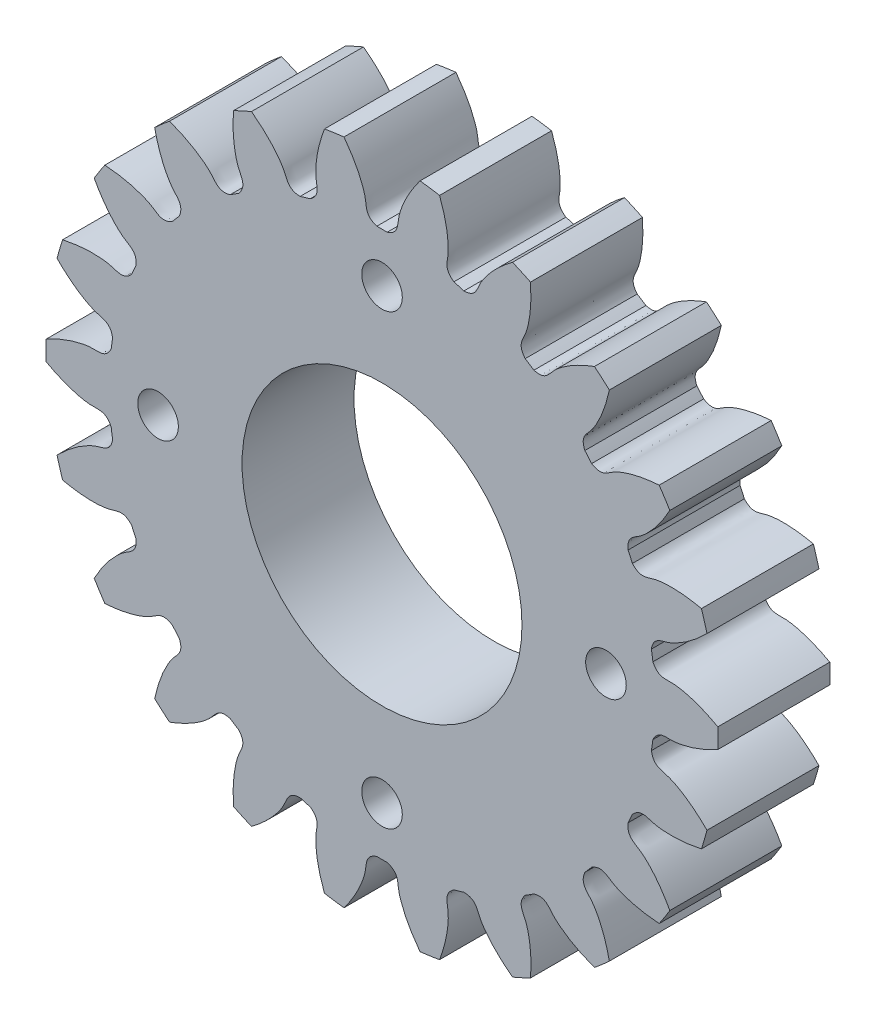
from build123d import *

# Parameters (mm, degrees)
SKETCH_1_R               = 24
EXTRUDE_1_DEPTH          = 8
CUT_EXTRUDE_1_DEPTH      = 35.871191548
PATTERN_CIRCULAR_1_COUNT = 22
SKETCH_4_R               = 1.45
CUT_EXTRUDE_2_DEPTH      = 35.765198942
SKETCH_5_R               = 10
CUT_EXTRUDE_3_DEPTH      = 35.765198942


with BuildPart() as part:
    # 草图1 → 凸台-拉伸1 (new body)
    with BuildSketch(Plane.XY):
        Circle(SKETCH_1_R)
    extrude(amount=EXTRUDE_1_DEPTH)

    # 草图2 → 切除-拉伸1 (cut, through all)
    with BuildSketch(Plane.XY):
        with BuildLine():
            ThreePointArc((0.371330863, 19.496464125), (0, 19.5), (-0.371330863, 19.496464125))
            add(Edge.make_bspline(
                [(-0.371330863, 19.496464125), (-1.176317412, 19.752372857), (-1.096694528, 20.303549391), (-1.199168094, 20.843140781), (-1.211922359, 20.903837805), (-1.227753794, 20.972324425), (-1.246967442, 21.048500862), (-1.269879867, 21.132255307), (-1.296799885, 21.223467323), (-1.328034341, 21.322006878), (-1.363885982, 21.427734756), (-1.40465378, 21.54050256), (-1.45063252, 21.660152836), (-1.502112606, 21.786519179), (-1.559379803, 21.919426344), (-1.622715011, 22.058690369), (-1.692394023, 22.204118701), (-1.768687299, 22.355510324), (-1.851859737, 22.512655901), (-1.94217045, 22.675337914), (-2.039872542, 22.843330816), (-2.145212897, 23.016401181), (-2.258431958, 23.19430787), (-2.379763526, 23.376802189), (-2.509434547, 23.563628066), (-2.647664919, 23.754522223), (-2.794667288, 23.949214355), (-2.950646862, 24.147427323), (-3.115801217, 24.348877336), (-3.29032012, 24.553274152), (-3.474385347, 24.760321276), (-3.668170511, 24.969716162), (-3.871840895, 25.181150429), (-4.085553283, 25.394310066), (-4.309455811, 25.608875654), (-4.543687807, 25.824522587), (-4.788379645, 26.040921297), (-5.043652617, 26.257737482), (-5.309618726, 26.474632342), (-5.682976253, 26.766871077), (-5.97289143, 26.979936205), (-6.171117596, 27.119736256)],
                knots=[0, 0, 0, 0, 0.157021319, 0.162530984, 0.168888289, 0.176093235, 0.184145822, 0.19304605, 0.202793918, 0.213389427, 0.224832576, 0.237123367, 0.250261798, 0.264247869, 0.279081582, 0.294762935, 0.311291928, 0.328668563, 0.346892838, 0.365964754, 0.38588431, 0.406651508, 0.428266346, 0.450728824, 0.474038944, 0.498196704, 0.523202104, 0.549055146, 0.575755828, 0.603304151, 0.631700114, 0.660943719, 0.691034964, 0.721973849, 0.753760376, 0.786394543, 0.819876351, 0.854205799, 0.889382888, 0.925407618, 1, 1, 1, 1], degree=3))
            ThreePointArc((-6.171117596, 27.119736256), (0, 27.812996728), (6.171117596, 27.119736256))
            add(Edge.make_bspline(
                [(0.371330863, 19.496464125), (1.176317412, 19.752372857), (1.096694528, 20.303549391), (1.199168094, 20.843140781), (1.211922359, 20.903837805), (1.227753794, 20.972324425), (1.246967442, 21.048500862), (1.269879867, 21.132255307), (1.296799885, 21.223467323), (1.328034341, 21.322006878), (1.363885982, 21.427734756), (1.40465378, 21.54050256), (1.45063252, 21.660152836), (1.502112606, 21.786519179), (1.559379803, 21.919426344), (1.622715011, 22.058690369), (1.692394023, 22.204118701), (1.768687299, 22.355510324), (1.851859737, 22.512655901), (1.94217045, 22.675337914), (2.039872542, 22.843330816), (2.145212897, 23.016401181), (2.258431958, 23.19430787), (2.379763526, 23.376802189), (2.509434547, 23.563628066), (2.647664919, 23.754522223), (2.794667288, 23.949214355), (2.950646862, 24.147427323), (3.115801217, 24.348877336), (3.29032012, 24.553274152), (3.474385347, 24.760321276), (3.668170511, 24.969716162), (3.871840895, 25.181150429), (4.085553283, 25.394310066), (4.309455811, 25.608875654), (4.543687807, 25.824522587), (4.788379645, 26.040921297), (5.043652617, 26.257737482), (5.309618726, 26.474632342), (5.682976253, 26.766871077), (5.97289143, 26.979936205), (6.171117596, 27.119736256)],
                knots=[0, 0, 0, 0, 0.157021319, 0.162530984, 0.168888289, 0.176093235, 0.184145822, 0.19304605, 0.202793918, 0.213389427, 0.224832576, 0.237123367, 0.250261798, 0.264247869, 0.279081582, 0.294762935, 0.311291928, 0.328668563, 0.346892838, 0.365964754, 0.38588431, 0.406651508, 0.428266346, 0.450728824, 0.474038944, 0.498196704, 0.523202104, 0.549055146, 0.575755828, 0.603304151, 0.631700114, 0.660943719, 0.691034964, 0.721973849, 0.753760376, 0.786394543, 0.819876351, 0.854205799, 0.889382888, 0.925407618, 1, 1, 1, 1], degree=3))
        make_face()
    cut_extrude_1 = extrude(amount=CUT_EXTRUDE_1_DEPTH, mode=Mode.SUBTRACT)

    # 阵列(圆周)1: 切除-拉伸1 ×22 about axis
    pattern_circular_1_axis = Axis((0, 0, -0.25), (0, 0, 1))
    for i in range(1, PATTERN_CIRCULAR_1_COUNT):
        add(cut_extrude_1.rotate(pattern_circular_1_axis, i * 360 / PATTERN_CIRCULAR_1_COUNT), mode=Mode.SUBTRACT)

    # 草图4 → 切除-拉伸2 (cut, through all)
    with BuildSketch(Plane.XY.offset(8)):
        with Locations((0, 16)):
            Circle(SKETCH_4_R)
        with Locations((16, 0)):
            Circle(SKETCH_4_R)
        with Locations((0, -16)):
            Circle(SKETCH_4_R)
        with Locations((-16, 0)):
            Circle(SKETCH_4_R)
    extrude(amount=-CUT_EXTRUDE_2_DEPTH, mode=Mode.SUBTRACT)

    # 草图5 → 切除-拉伸3 (cut, through all)
    with BuildSketch(Plane.XY.offset(8)):
        Circle(SKETCH_5_R)
    extrude(amount=-CUT_EXTRUDE_3_DEPTH, mode=Mode.SUBTRACT)


solid = part.part
